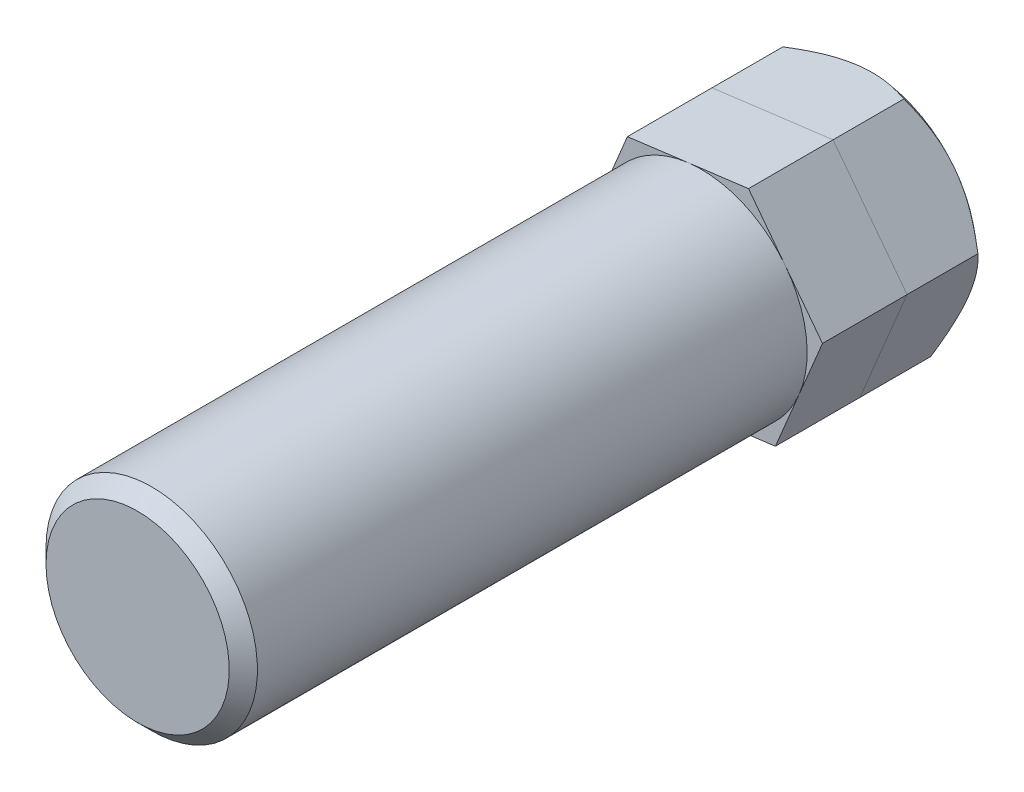
from build123d import *

# Parameters (mm, degrees)
SKETCH1_W           = 7.5
SKETCH1_H           = 40
BOSS_EXTRUDE1_DEPTH = 6
BOSS_EXTRUDE2_DEPTH = 6
SKETCH4_OUTSIDE_W   = 35.356
SKETCH4_OUTSIDE_H   = 34.156
SKETCH4_OUTSIDE_R   = 7.5
CUT_EXTRUDE1_DEPTH  = 2
CUT_EXTRUDE1_DRAFT  = -50
CHAMFER1_SIZE       = 1


with BuildPart() as part:
    # Sketch1 → Revolve1 (revolve)
    with BuildSketch(Plane(origin=(0, 0, 0), x_dir=(1, 0, 0), z_dir=(0, 1, 0))):
        with Locations((3.75, 20)):
            Rectangle(SKETCH1_W, SKETCH1_H)
    revolve(axis=Axis((0, 0, -40), (0, 0, 1)))

    # Sketch2 → Boss-Extrude1 (add)
    with BuildSketch(Plane(origin=(0, 0, -40), x_dir=(-1, 0, 0), z_dir=(0, 0, -1))):
        Polygon((-3.341179099, 7.989776106), (-8.589938628, 1.101342075), (-5.248759529, -6.888434031), (3.341179099, -7.989776106), (8.589938628, -1.101342075), (5.248759529, 6.888434031), align=None)
    extrude(amount=BOSS_EXTRUDE1_DEPTH)

    # Chamfer1
    chamfer1_edges = [part.edges().sort_by_distance(p)[0] for p in [
        (-7.5, 0, 0),
    ]]
    chamfer(chamfer1_edges, length=CHAMFER1_SIZE)


with BuildPart() as body_2:
    # Sketch3 → Boss-Extrude2 (new body)
    with BuildSketch(Plane(origin=(0, 0, -46), x_dir=(-1, 0, 0), z_dir=(0, 0, -1))):
        Polygon((5.248759529, 6.888434031), (-3.341179099, 7.989776106), (-8.589938628, 1.101342075), (-5.248759529, -6.888434031), (3.341179099, -7.989776106), (8.589938628, -1.101342075), align=None)
    extrude(amount=BOSS_EXTRUDE2_DEPTH)


with BuildPart() as cut_extrude1_tool:
    # Sketch4 outside → Cut-Extrude1 (with draft: the straight prism first)
    with BuildSketch(Plane(origin=(0, 0, -52), x_dir=(-1, 0, 0), z_dir=(0, 0, -1))):
        Rectangle(SKETCH4_OUTSIDE_W, SKETCH4_OUTSIDE_H)
        Circle(SKETCH4_OUTSIDE_R, mode=Mode.SUBTRACT)
    extrude(amount=-CUT_EXTRUDE1_DEPTH)
    # Cut-Extrude1: the draft: its side faces are tilted about the plane it starts from
    cut_extrude1_sides = [cut_extrude1_tool.faces().sort_by_distance(p)[0] for p in [
        (0, -17.078, -51),
        (-17.678, 0, -51),
        (0, 17.078, -51),
        (17.678, 0, -51),
        (7.5, 0, -51),
    ]]
    draft(cut_extrude1_sides, Plane(origin=(0, 0, -52), x_dir=(-1, 0, 0), z_dir=(0, 0, -1)), CUT_EXTRUDE1_DRAFT)


with BuildPart() as body_2_1:
    add(body_2.part)

    # Cut-Extrude1: cut by cut_extrude1_tool
    add(cut_extrude1_tool.part, mode=Mode.SUBTRACT)


solid = Compound([part.part, body_2_1.part])
